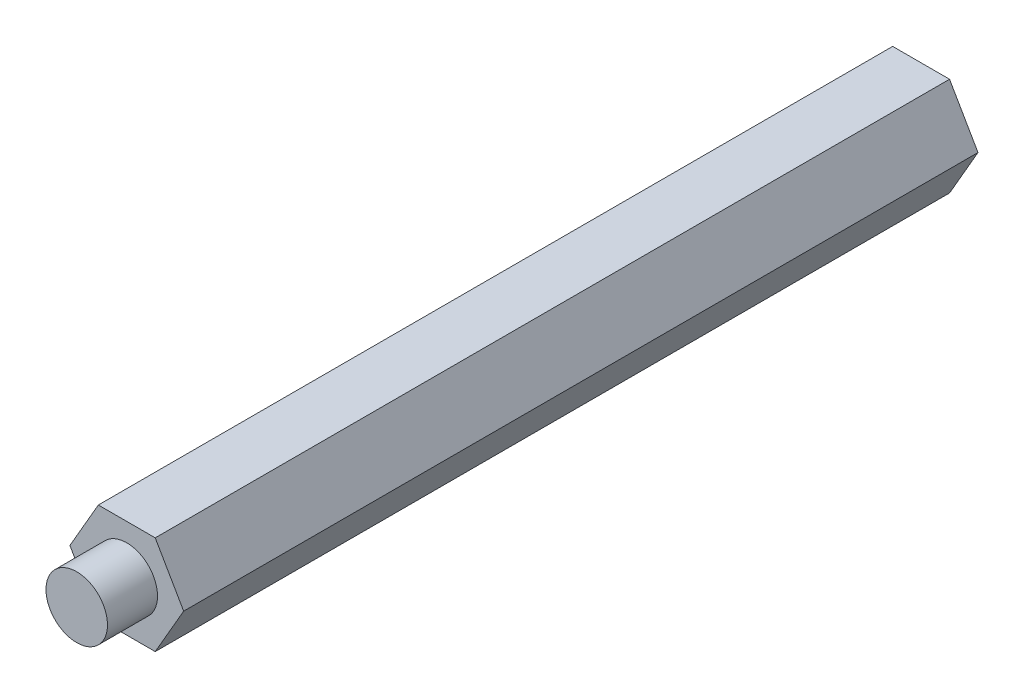
from build123d import *

# Parameters (mm, degrees)
BOSS_EXTRUDE1_DEPTH = 50.385
SKETCH3_R           = 1.95
BOSS_EXTRUDE2_DEPTH = 3.175


with BuildPart() as part:
    # Sketch1 → Boss-Extrude1 (new body)
    with BuildSketch(Plane.XY):
        Polygon((3.608439182, 0), (1.804219591, 3.125), (-1.804219591, 3.125), (-3.608439182, 0), (-1.804219591, -3.125), (1.804219591, -3.125), align=None)
    extrude(amount=BOSS_EXTRUDE1_DEPTH)

    # Sketch3 → Boss-Extrude2 (add)
    with BuildSketch(Plane.XY.offset(50.385)):
        with Locations(Location((0, 0, 0), (0, 0, 270))):
            Circle(SKETCH3_R)
    extrude(amount=BOSS_EXTRUDE2_DEPTH)


solid = part.part
